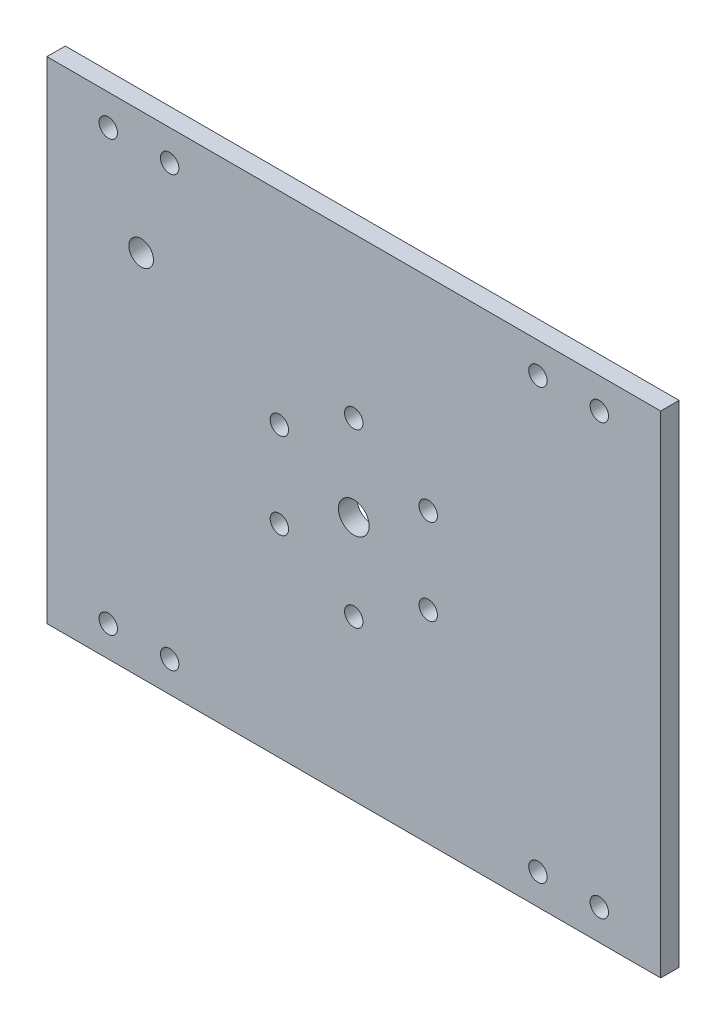
from build123d import *

# Parameters (mm, degrees)
SKETCH_1_W          = 100
SKETCH_1_H          = 80
SKETCH_1_R          = 1.5
SKETCH_1_R_2        = 2.5
EXTRUDE_1_DEPTH     = 3
SKETCH_2_R          = 1.5
CUT_EXTRUDE_1_DEPTH = 10
SKETCH_3_R          = 2
CUT_EXTRUDE_2_DEPTH = 65.101482042


with BuildPart() as part:
    # 草图1 → 凸台-拉伸1 (new body)
    with BuildSketch(Plane.XY):
        Rectangle(SKETCH_1_W, SKETCH_1_H)
        with Locations((0, 14)):
            Circle(SKETCH_1_R, mode=Mode.SUBTRACT)
        with Locations((12.124355653, 7)):
            Circle(SKETCH_1_R, mode=Mode.SUBTRACT)
        with Locations((12.124355653, -7)):
            Circle(SKETCH_1_R, mode=Mode.SUBTRACT)
        with Locations((0, -14)):
            Circle(SKETCH_1_R, mode=Mode.SUBTRACT)
        with Locations((-12.124355653, -7)):
            Circle(SKETCH_1_R, mode=Mode.SUBTRACT)
        with Locations((-12.124355653, 7)):
            Circle(SKETCH_1_R, mode=Mode.SUBTRACT)
        Circle(SKETCH_1_R_2, mode=Mode.SUBTRACT)
    extrude(amount=EXTRUDE_1_DEPTH)

    # 草图2 → 切除-拉伸1 (cut)
    with BuildSketch(Plane(origin=(0, 0, 0), x_dir=(-1, 0, 0), z_dir=(0, 0, -1))):
        with Locations((-40, 35)):
            Circle(SKETCH_2_R)
        with Locations((-30, 35)):
            Circle(SKETCH_2_R)
        with Locations(Location((30, 35, 0), (0, 0, 180))):
            Circle(SKETCH_2_R)
        with Locations(Location((40, 35, 0), (0, 0, 180))):
            Circle(SKETCH_2_R)
        with Locations((40, -35)):
            Circle(SKETCH_2_R)
        with Locations((30, -35)):
            Circle(SKETCH_2_R)
        with Locations(Location((-30, -35, 0), (0, 0, 180))):
            Circle(SKETCH_2_R)
        with Locations(Location((-40, -35, 0), (0, 0, 180))):
            Circle(SKETCH_2_R)
    extrude(amount=-CUT_EXTRUDE_1_DEPTH, mode=Mode.SUBTRACT)

    # 草图3 → 切除-拉伸2 (cut, through all)
    with BuildSketch(Plane(origin=(0, 0, 0), x_dir=(-1, 0, 0), z_dir=(0, 0, -1))):
        with Locations((34.641016151, 20)):
            Circle(SKETCH_3_R)
    extrude(amount=-CUT_EXTRUDE_2_DEPTH, mode=Mode.SUBTRACT)


solid = part.part
